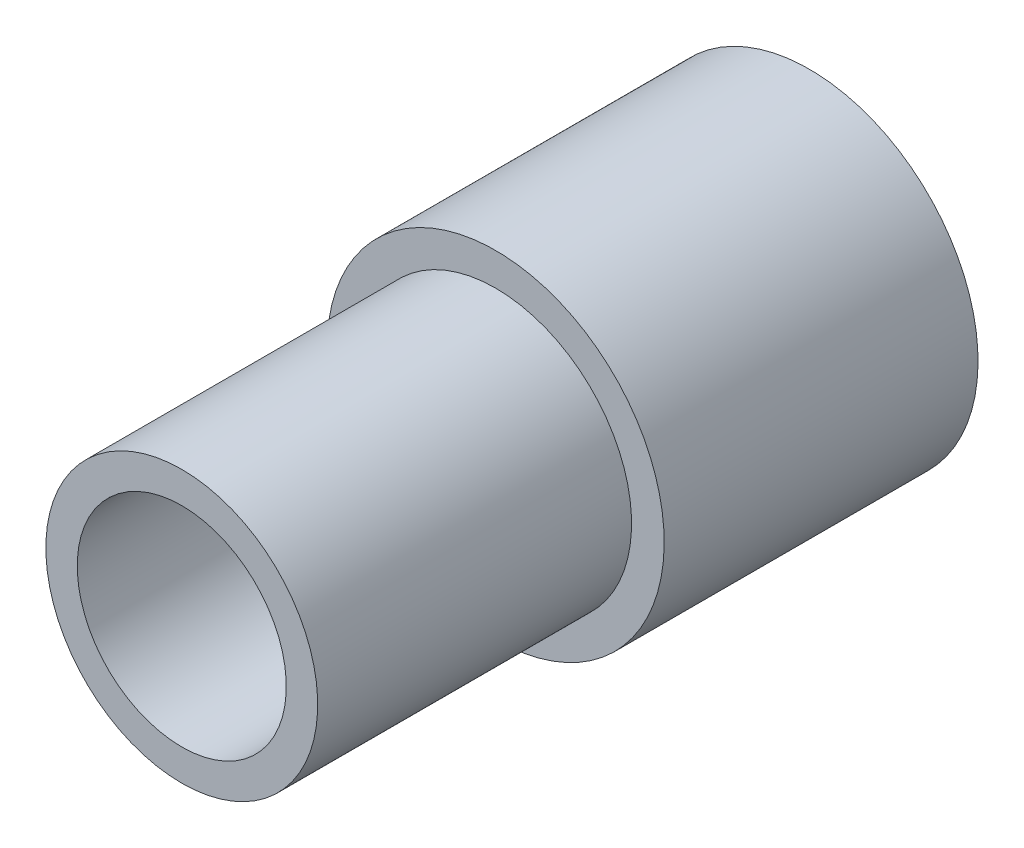
from build123d import *


with BuildPart() as part:
    # Sketch1 → Revolve1 (revolve)
    with BuildSketch(Plane(origin=(0, 0, 0), x_dir=(0, 0, -1), z_dir=(1, 0, 0))):
        Polygon((-27.655022434, 11), (-2.255022434, 11), (-2.255022434, 13.64), (23.144977566, 13.64), (23.144977566, 11.1), (0.284977566, 11.1), (0.284977566, 8.46), (-27.655022434, 8.46), align=None)
        with BuildLine():
            Line((-1.298567003, 0), (20.108081425, 0))
            ThreePointArc((20.108081425, 0), (9.404757211, 10.703324214), (-1.298567003, 0))
        make_face()
    revolve(axis=Axis((0, 0, 27.655022434), (0, 0, -1)))


solid = part.part
